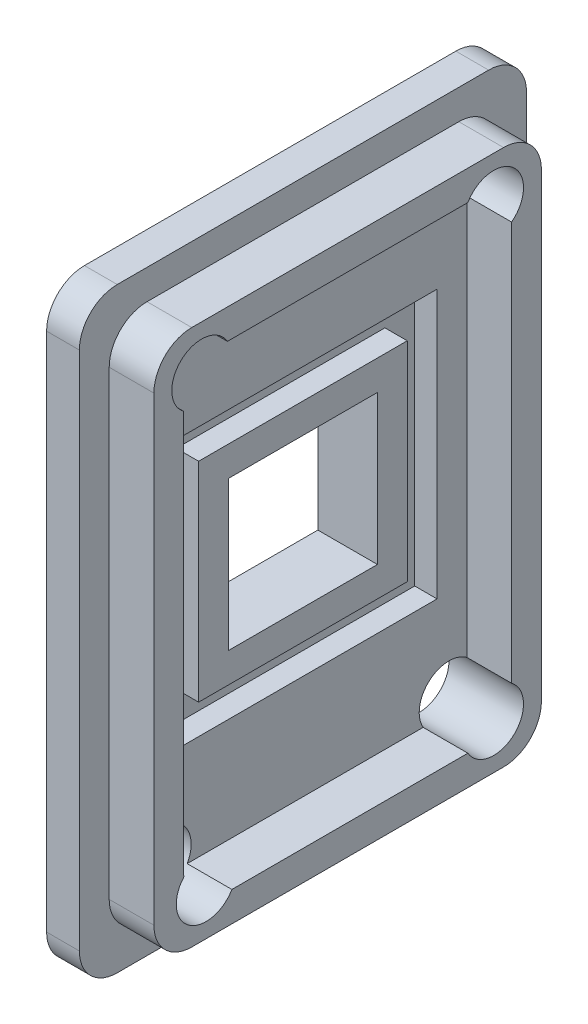
from build123d import *

# Parameters (mm, degrees)
BOSS_EXTRUDE2_DEPTH  = 2
SKETCH3_W            = 6
SKETCH3_H            = 6
CUT_EXTRUDE1_DEPTH   = 2
SKETCH4_R            = 5
BOSS_EXTRUDE3_DEPTH  = 1.5
SKETCH5_W            = 12
SKETCH5_H            = 12
BOSS_EXTRUDE4_DEPTH  = 1
SKETCH6_W            = 6
SKETCH6_H            = 6
CUT_EXTRUDE2_DEPTH   = 10
SKETCH7_W            = 16
SKETCH7_H            = 16
BOSS_EXTRUDE5_DEPTH  = 1
SKETCH9_R            = 6
BOSS_EXTRUDE6_DEPTH  = 1
SKETCH10_W           = 6
SKETCH10_H           = 6
CUT_EXTRUDE3_DEPTH   = 10
BOSS_EXTRUDE7_DEPTH  = 3
CUT_EXTRUDE4_DEPTH   = 1
SKETCH13_W           = 14
SKETCH13_H           = 14
SKETCH13_W_2         = 10
SKETCH13_H_2         = 10
CUT_EXTRUDE5_DEPTH   = 1.5
BOSS_EXTRUDE8_DEPTH  = 3
SKETCH16_R           = 7
BOSS_EXTRUDE9_DEPTH  = 1
SKETCH17_W           = 6
SKETCH17_H           = 6
CUT_EXTRUDE7_DEPTH   = 4
SKETCH18_W           = 8
SKETCH18_H           = 8
CUT_EXTRUDE8_DEPTH   = 10
SKETCH19_W           = 12
SKETCH19_H           = 12
SKETCH19_W_2         = 8
SKETCH19_H_2         = 8
BOSS_EXTRUDE10_DEPTH = 1.5
SKETCH20_W           = 16
SKETCH20_H           = 16
SKETCH20_W_2         = 12
SKETCH20_H_2         = 12
CUT_EXTRUDE9_DEPTH   = 1.5
SKETCH23_W           = 10
SKETCH23_H           = 10
SKETCH23_W_2         = 8
SKETCH23_H_2         = 8
CUT_EXTRUDE15_DEPTH  = 10
SKETCH24_R           = 8
BOSS_EXTRUDE11_DEPTH = 1
SKETCH25_W           = 10
SKETCH25_H           = 10
CUT_EXTRUDE16_DEPTH  = 1
BOSS_EXTRUDE12_DEPTH = 1
SKETCH27_W           = 10
SKETCH27_H           = 10
CUT_EXTRUDE17_DEPTH  = 1
SKETCH28_W           = 14
SKETCH28_H           = 14
SKETCH28_W_2         = 12
SKETCH28_H_2         = 12
BOSS_EXTRUDE13_DEPTH = 1.5
SKETCH29_W           = 18
SKETCH29_H           = 18
SKETCH29_W_2         = 16
SKETCH29_H_2         = 16
CUT_EXTRUDE18_DEPTH  = 1.5
BOSS_EXTRUDE14_START = 0.2
BOSS_EXTRUDE14_DEPTH = 0.2
SKETCH31_R           = 2
CUT_EXTRUDE19_DEPTH  = 7.826


with BuildPart() as part:
    # Sketch2 → Boss-Extrude2 (new body)
    with BuildSketch(Plane(origin=(0, 0, 0), x_dir=(0, 0, -1), z_dir=(1, 0, 0))):
        with BuildLine():
            Line((2.54, 0), (27.46, 0))
            ThreePointArc((27.46, 0), (29.256051224, 0.743948776), (30, 2.54))
            Line((30, 2.54), (30, 37.46))
            ThreePointArc((30, 37.46), (29.256051224, 39.256051224), (27.46, 40))
            Line((27.46, 40), (2.54, 40))
            ThreePointArc((2.54, 40), (0.743948776, 39.256051224), (0, 37.46))
            Line((0, 37.46), (0, 2.54))
            ThreePointArc((0, 2.54), (0.743948776, 0.743948776), (2.54, 0))
        make_face()
    extrude(amount=BOSS_EXTRUDE2_DEPTH)

    # Sketch3 → Cut-Extrude1 (cut)
    with BuildSketch(Plane.ZY):
        with Locations((-15, 20)):
            Rectangle(SKETCH3_W, SKETCH3_H)
    extrude(amount=-CUT_EXTRUDE1_DEPTH, mode=Mode.SUBTRACT)

    # Sketch4 → Boss-Extrude3 (add)
    with BuildSketch(Plane.ZY):
        with Locations((-15, 20)):
            Circle(SKETCH4_R)
    extrude(amount=BOSS_EXTRUDE3_DEPTH)

    # Sketch5 → Boss-Extrude4 (add)
    with BuildSketch(Plane.ZY):
        with Locations((-15, 20)):
            Rectangle(SKETCH5_W, SKETCH5_H)
    extrude(amount=BOSS_EXTRUDE4_DEPTH)

    # Sketch6 → Cut-Extrude2 (cut)
    with BuildSketch(Plane(origin=(2, 0, 0), x_dir=(0, 0, -1), z_dir=(1, 0, 0))):
        with Locations((15, 20)):
            Rectangle(SKETCH6_W, SKETCH6_H)
    extrude(amount=-CUT_EXTRUDE2_DEPTH, mode=Mode.SUBTRACT)

    # Sketch7 → Boss-Extrude5 (add)
    with BuildSketch(Plane.ZY):
        with Locations((-15, 20)):
            Rectangle(SKETCH7_W, SKETCH7_H)
    extrude(amount=BOSS_EXTRUDE5_DEPTH)

    # Sketch9 → Boss-Extrude6 (add)
    with BuildSketch(Plane.ZY.offset(1)):
        with Locations(Location((-15, 20, 0), (0, 0, 180))):
            Circle(SKETCH9_R)
    extrude(amount=BOSS_EXTRUDE6_DEPTH)

    # Sketch10 → Cut-Extrude3 (cut)
    with BuildSketch(Plane(origin=(0, 0, 0), x_dir=(0, 0, -1), z_dir=(1, 0, 0))):
        with Locations((15, 20)):
            Rectangle(SKETCH10_W, SKETCH10_H)
    extrude(amount=-CUT_EXTRUDE3_DEPTH, mode=Mode.SUBTRACT)

    # Sketch11 → Boss-Extrude7 (add)
    with BuildSketch(Plane(origin=(2, 0, 0), x_dir=(0, 0, -1), z_dir=(1, 0, 0))):
        with BuildLine():
            Line((4.54, 38), (25.46, 38))
            ThreePointArc((25.46, 38), (27.256051224, 37.256051224), (28, 35.46))
            Line((28, 35.46), (28, 4.54))
            ThreePointArc((28, 4.54), (27.256051224, 2.743948776), (25.46, 2))
            Line((25.46, 2), (4.54, 2))
            ThreePointArc((4.54, 2), (2.743948776, 2.743948776), (2, 4.54))
            Line((2, 4.54), (2, 35.46))
            ThreePointArc((2, 35.46), (2.743948776, 37.256051224), (4.54, 38))
        make_face()
        with BuildLine():
            Line((6.54, 36), (23.46, 36))
            ThreePointArc((23.46, 36), (25.256051224, 35.256051224), (26, 33.46))
            Line((26, 33.46), (26, 6.54))
            ThreePointArc((26, 6.54), (25.256051224, 4.743948776), (23.46, 4))
            Line((23.46, 4), (6.54, 4))
            ThreePointArc((6.54, 4), (4.743948776, 4.743948776), (4, 6.54))
            Line((4, 6.54), (4, 33.46))
            ThreePointArc((4, 33.46), (4.743948776, 35.256051224), (6.54, 36))
        make_face(mode=Mode.SUBTRACT)
    extrude(amount=BOSS_EXTRUDE7_DEPTH)

    # Sketch12 → Cut-Extrude4 (cut)
    with BuildSketch(Plane.ZY.offset(1)):
        with BuildLine():
            Line((-23, 28), (-20.46, 28))
            ThreePointArc((-20.46, 28), (-22.256051224, 27.256051224), (-23, 25.46))
            Line((-23, 25.46), (-23, 28))
        make_face()
        with BuildLine():
            Line((-7, 28), (-7, 25.46))
            ThreePointArc((-7, 25.46), (-7.743948776, 27.256051224), (-9.54, 28))
            Line((-9.54, 28), (-7, 28))
        make_face()
        with BuildLine():
            Line((-7, 12), (-9.54, 12))
            ThreePointArc((-9.54, 12), (-7.743948776, 12.743948776), (-7, 14.54))
            Line((-7, 14.54), (-7, 12))
        make_face()
        with BuildLine():
            Line((-23, 12), (-23, 14.54))
            ThreePointArc((-23, 14.54), (-22.256051224, 12.743948776), (-20.46, 12))
            Line((-20.46, 12), (-23, 12))
        make_face()
    extrude(amount=-CUT_EXTRUDE4_DEPTH, mode=Mode.SUBTRACT)

    # Sketch13 → Cut-Extrude5 (cut)
    with BuildSketch(Plane(origin=(2, 0, 0), x_dir=(0, 0, -1), z_dir=(1, 0, 0))):
        with Locations((15, 20)):
            Rectangle(SKETCH13_W, SKETCH13_H)
        with Locations((15, 20)):
            Rectangle(SKETCH13_W_2, SKETCH13_H_2, mode=Mode.SUBTRACT)
    extrude(amount=-CUT_EXTRUDE5_DEPTH, mode=Mode.SUBTRACT)

    # Sketch14 → Boss-Extrude8 (add)
    with BuildSketch(Plane.ZY.offset(2)):
        with BuildLine():
            Line((-17.46, 25), (-12.54, 25))
            ThreePointArc((-12.54, 25), (-10.743948776, 24.256051224), (-10, 22.46))
            Line((-10, 22.46), (-10, 17.54))
            ThreePointArc((-10, 17.54), (-10.743948776, 15.743948776), (-12.54, 15))
            Line((-12.54, 15), (-17.46, 15))
            ThreePointArc((-17.46, 15), (-19.256051224, 15.743948776), (-20, 17.54))
            Line((-20, 17.54), (-20, 22.46))
            ThreePointArc((-20, 22.46), (-19.256051224, 24.256051224), (-17.46, 25))
        make_face()
    extrude(amount=-BOSS_EXTRUDE8_DEPTH)

    # Sketch16 → Boss-Extrude9 (add)
    with BuildSketch(Plane.ZY.offset(2)):
        with Locations((-15, 20)):
            Circle(SKETCH16_R)
    extrude(amount=-BOSS_EXTRUDE9_DEPTH)

    # Sketch17 → Cut-Extrude7 (cut)
    with BuildSketch(Plane(origin=(1, 0, 0), x_dir=(0, 0, -1), z_dir=(1, 0, 0))):
        with Locations((15, 20)):
            Rectangle(SKETCH17_W, SKETCH17_H)
    extrude(amount=-CUT_EXTRUDE7_DEPTH, mode=Mode.SUBTRACT)

    # Sketch18 → Cut-Extrude8 (cut)
    with BuildSketch(Plane.ZY.offset(2)):
        with Locations((-15, 20)):
            Rectangle(SKETCH18_W, SKETCH18_H)
    extrude(amount=-CUT_EXTRUDE8_DEPTH, mode=Mode.SUBTRACT)

    # Sketch19 → Boss-Extrude10 (add)
    with BuildSketch(Plane(origin=(0.5, 0, 0), x_dir=(0, 0, -1), z_dir=(1, 0, 0))):
        with Locations((15, 20)):
            Rectangle(SKETCH19_W, SKETCH19_H)
        with Locations((15, 20)):
            Rectangle(SKETCH19_W_2, SKETCH19_H_2, mode=Mode.SUBTRACT)
    extrude(amount=BOSS_EXTRUDE10_DEPTH)

    # Sketch20 → Cut-Extrude9 (cut)
    with BuildSketch(Plane(origin=(2, 0, 0), x_dir=(0, 0, -1), z_dir=(1, 0, 0))):
        with Locations((15, 20)):
            Rectangle(SKETCH20_W, SKETCH20_H)
        with Locations((15, 20)):
            Rectangle(SKETCH20_W_2, SKETCH20_H_2, mode=Mode.SUBTRACT)
    extrude(amount=-CUT_EXTRUDE9_DEPTH, mode=Mode.SUBTRACT)

    # Sketch23 → Cut-Extrude15 (cut)
    with BuildSketch(Plane(origin=(2, 0, 0), x_dir=(0, 0, -1), z_dir=(1, 0, 0))):
        with Locations((15, 20)):
            Rectangle(SKETCH23_W, SKETCH23_H)
        with Locations((15, 20)):
            Rectangle(SKETCH23_W_2, SKETCH23_H_2, mode=Mode.SUBTRACT)
    extrude(amount=-CUT_EXTRUDE15_DEPTH, mode=Mode.SUBTRACT)

    # Sketch24 → Boss-Extrude11 (add)
    with BuildSketch(Plane.ZY.offset(1)):
        with Locations((-15, 20)):
            Circle(SKETCH24_R)
    extrude(amount=BOSS_EXTRUDE11_DEPTH)

    # Sketch25 → Cut-Extrude16 (cut)
    with BuildSketch(Plane(origin=(-1, 0, 0), x_dir=(0, 0, -1), z_dir=(1, 0, 0))):
        with Locations((15, 20)):
            Rectangle(SKETCH25_W, SKETCH25_H)
    extrude(amount=-CUT_EXTRUDE16_DEPTH, mode=Mode.SUBTRACT)

    # Sketch26 → Boss-Extrude12 (add)
    with BuildSketch(Plane.ZY):
        with BuildLine():
            Line((-21.46, 29), (-8.54, 29))
            ThreePointArc((-8.54, 29), (-6.743948776, 28.256051224), (-6, 26.46))
            Line((-6, 26.46), (-6, 13.54))
            ThreePointArc((-6, 13.54), (-6.743948776, 11.743948776), (-8.54, 11))
            Line((-8.54, 11), (-21.46, 11))
            ThreePointArc((-21.46, 11), (-23.256051224, 11.743948776), (-24, 13.54))
            Line((-24, 13.54), (-24, 26.46))
            ThreePointArc((-24, 26.46), (-23.256051224, 28.256051224), (-21.46, 29))
        make_face()
    extrude(amount=BOSS_EXTRUDE12_DEPTH)

    # Sketch27 → Cut-Extrude17 (cut)
    with BuildSketch(Plane(origin=(0, 0, 0), x_dir=(0, 0, -1), z_dir=(1, 0, 0))):
        with Locations((15, 20)):
            Rectangle(SKETCH27_W, SKETCH27_H)
    extrude(amount=-CUT_EXTRUDE17_DEPTH, mode=Mode.SUBTRACT)

    # Sketch28 → Boss-Extrude13 (add)
    with BuildSketch(Plane(origin=(0.5, 0, 0), x_dir=(0, 0, -1), z_dir=(1, 0, 0))):
        with Locations((15, 20)):
            Rectangle(SKETCH28_W, SKETCH28_H)
        with Locations((15, 20)):
            Rectangle(SKETCH28_W_2, SKETCH28_H_2, mode=Mode.SUBTRACT)
    extrude(amount=BOSS_EXTRUDE13_DEPTH)

    # Sketch29 → Cut-Extrude18 (cut)
    with BuildSketch(Plane(origin=(2, 0, 0), x_dir=(0, 0, -1), z_dir=(1, 0, 0))):
        with Locations((15, 20)):
            Rectangle(SKETCH29_W, SKETCH29_H)
        with Locations((15, 20)):
            Rectangle(SKETCH29_W_2, SKETCH29_H_2, mode=Mode.SUBTRACT)
    extrude(amount=-CUT_EXTRUDE18_DEPTH, mode=Mode.SUBTRACT)

    # Sketch30 → Boss-Extrude14 (add)
    with BuildSketch(Plane.ZY.offset(BOSS_EXTRUDE14_START)):
        with BuildLine():
            Line((-27.46, 40), (-2.54, 40))
            ThreePointArc((-2.54, 40), (-0.743948776, 39.256051224), (0, 37.46))
            Line((0, 37.46), (0, 2.54))
            ThreePointArc((0, 2.54), (-0.743948776, 0.743948776), (-2.54, 0))
            Line((-2.54, 0), (-27.46, 0))
            ThreePointArc((-27.46, 0), (-29.256051224, 0.743948776), (-30, 2.54))
            Line((-30, 2.54), (-30, 37.46))
            ThreePointArc((-30, 37.46), (-29.256051224, 39.256051224), (-27.46, 40))
        make_face()
        with BuildLine():
            Line((-26.96, 39.5), (-3.04, 39.5))
            ThreePointArc((-3.04, 39.5), (-1.243948776, 38.756051224), (-0.5, 36.96))
            Line((-0.5, 36.96), (-0.5, 3.14))
            ThreePointArc((-0.5, 3.14), (-1.243948776, 1.343948776), (-3.04, 0.6))
            Line((-3.04, 0.6), (-26.96, 0.6))
            ThreePointArc((-26.96, 0.6), (-28.756051224, 1.343948776), (-29.5, 3.14))
            Line((-29.5, 3.14), (-29.5, 36.96))
            ThreePointArc((-29.5, 36.96), (-28.756051224, 38.756051224), (-26.96, 39.5))
        make_face(mode=Mode.SUBTRACT)
    extrude(amount=-BOSS_EXTRUDE14_DEPTH)

    # Sketch31 → Cut-Extrude19 (cut, symmetric)
    with BuildSketch(Plane(origin=(2, 0, 0), x_dir=(0, 0, -1), z_dir=(1, 0, 0))):
        with Locations(Location((5.2, 35, 0), (0, 0, 30))):
            Circle(SKETCH31_R)
        with Locations(Location((24.8, 35, 0), (0, 0, 306.869897646))):
            Circle(SKETCH31_R)
        with Locations(Location((24.8, 5, 0), (0, 0, 53.130102354))):
            Circle(SKETCH31_R)
        with Locations(Location((5.5, 5, 0), (0, 0, 330))):
            Circle(SKETCH31_R)
    extrude(amount=CUT_EXTRUDE19_DEPTH, both=True, mode=Mode.SUBTRACT)


solid = part.part
